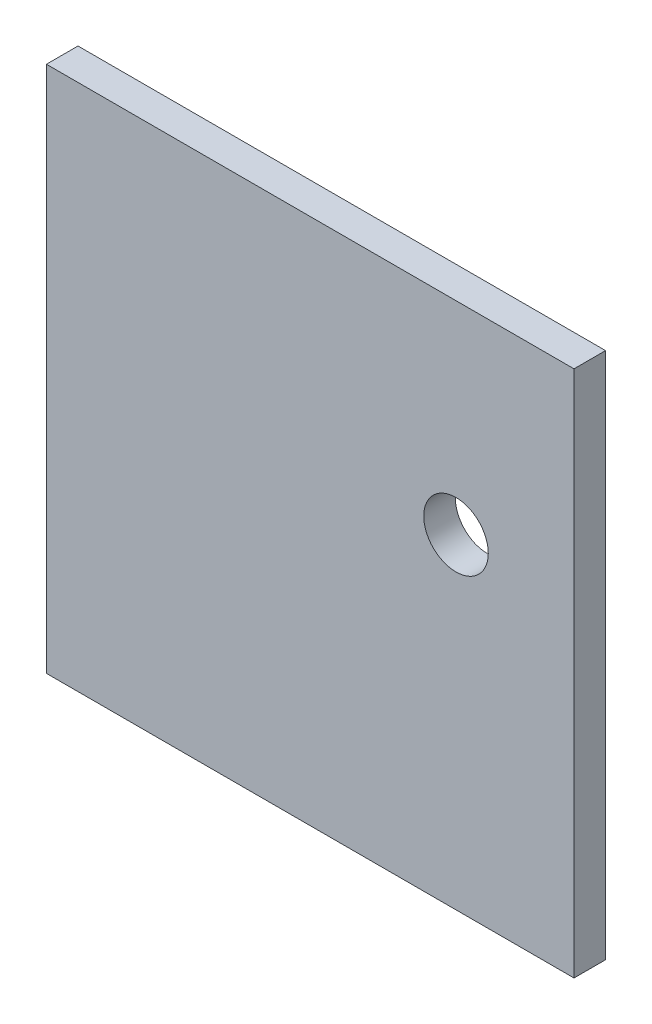
from build123d import *

# Parameters (mm, degrees)
SKETCH1_W      = 152.828642472
SKETCH1_H      = 152.828642472
SKETCH1_R      = 9.347426307
EXTRUDE1_DEPTH = 9.144


with BuildPart() as part:
    # Sketch1 → Extrude1 (new body)
    with BuildSketch(Plane.XY):
        Rectangle(SKETCH1_W, SKETCH1_H)
        with Locations((42.234252899, 17.704783599)):
            Circle(SKETCH1_R, mode=Mode.SUBTRACT)
    extrude(amount=-EXTRUDE1_DEPTH)


solid = part.part
